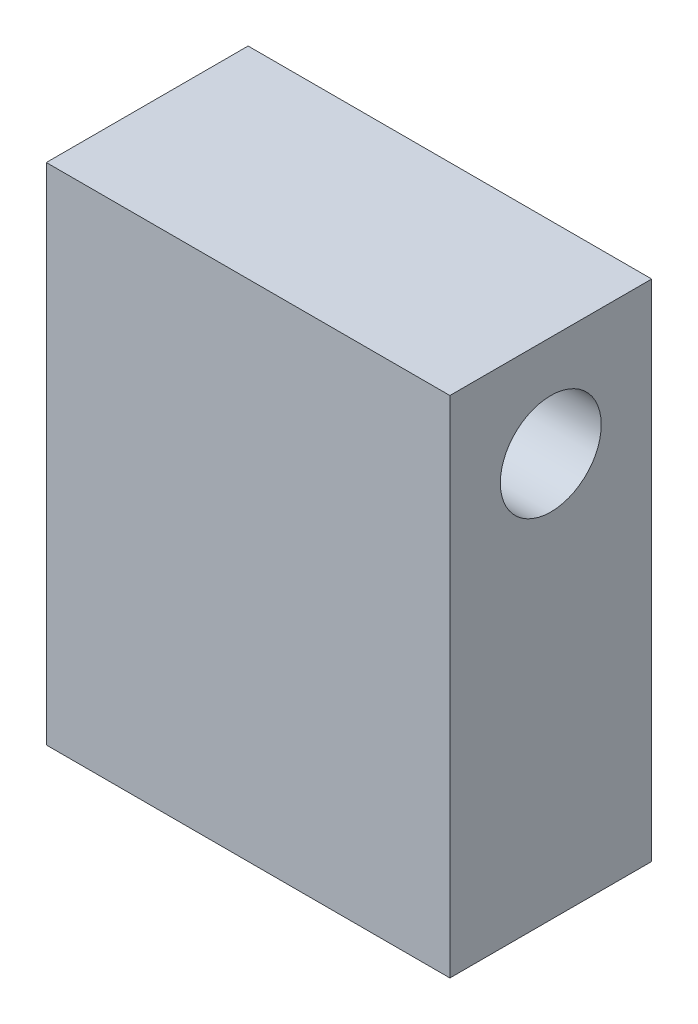
from build123d import *

# Parameters (mm, degrees)
SKETCH1_W           = 20
SKETCH1_H           = 10
BOSS_EXTRUDE1_DEPTH = 25
SKETCH2_R           = 1.5
CUT_EXTRUDE1_DEPTH  = 10
SKETCH3_R           = 2.5
CUT_EXTRUDE2_DEPTH  = 20


with BuildPart() as part:
    # Sketch1 → Boss-Extrude1 (new body)
    with BuildSketch(Plane(origin=(0, 0, 0), x_dir=(1, 0, 0), z_dir=(0, 1, 0))):
        Rectangle(SKETCH1_W, SKETCH1_H)
    extrude(amount=BOSS_EXTRUDE1_DEPTH)

    # Sketch2 → Cut-Extrude1 (cut)
    with BuildSketch(Plane(origin=(0, 0, 0), x_dir=(1, 0, 0), z_dir=(0, 1, 0))):
        with Locations(Location((-5, 0, 0), (0, 0, 270))):
            Circle(SKETCH2_R)
        with Locations(Location((5, 0, 0), (0, 0, 270))):
            Circle(SKETCH2_R)
    extrude(amount=CUT_EXTRUDE1_DEPTH, mode=Mode.SUBTRACT)

    # Sketch3 → Cut-Extrude2 (cut, symmetric)
    with BuildSketch(Plane(origin=(0, 0, 0), x_dir=(0, 0, -1), z_dir=(1, 0, 0))):
        with Locations((0, 20)):
            Circle(SKETCH3_R)
    extrude(amount=CUT_EXTRUDE2_DEPTH, both=True, mode=Mode.SUBTRACT)


solid = part.part
